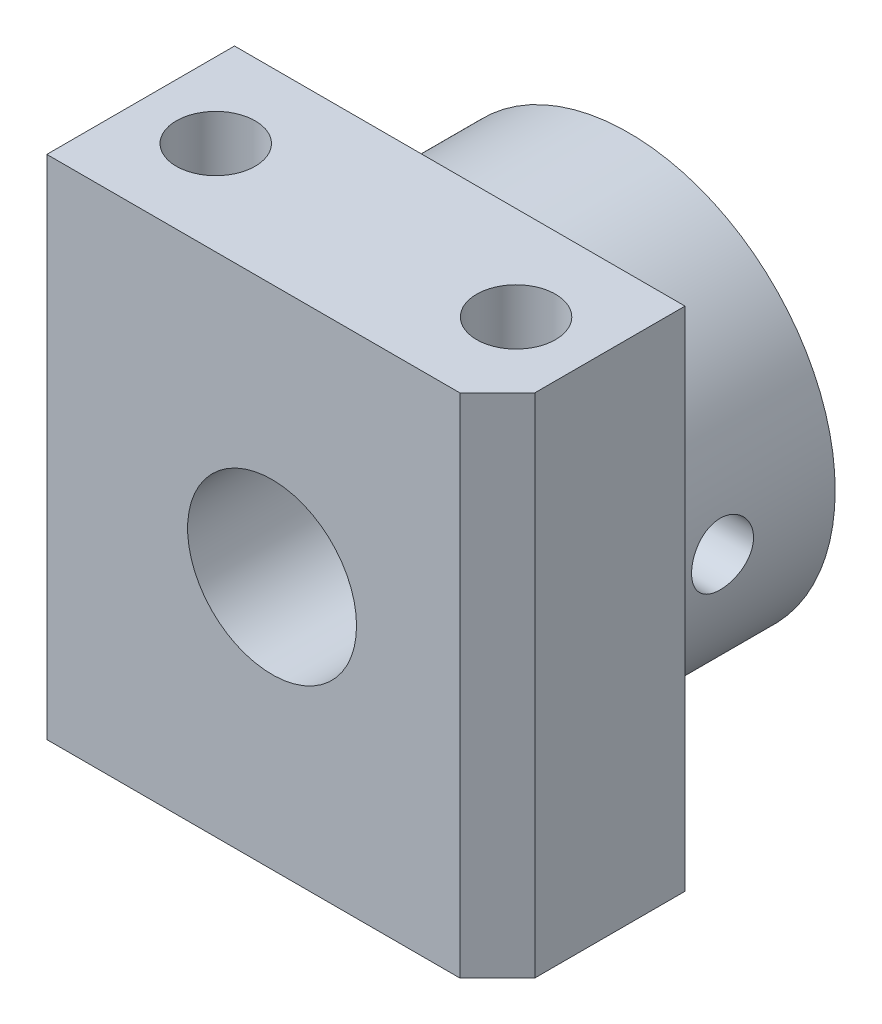
from build123d import *

# Parameters (mm, degrees)
SKETCH_1_W             = 24
SKETCH_1_H             = 27
EXTRUDE_1_DEPTH        = 10
SKETCH_2_R             = 11
SKETCH_2_R_2           = 4.5
EXTRUDE_2_DEPTH        = 9
CUT_EXTRUDE_START      = -41
SKETCH_3_R             = 4.5
CUT_EXTRUDE_1_DEPTH    = 41
SKETCH_4_R             = 2.1
CUT_EXTRUDE_2_DEPTH    = 37.013519789
CHAMFER_1_SIZE         = 2
HOLE_WIZARD_M4_1_D     = 3.3
HOLE_WIZARD_M4_1_DEPTH = 11.5
HOLE_WIZARD_M4_1_TIP   = 0.991420021


with BuildPart() as part:
    # 草图1 → 凸台-拉伸1 (new body)
    with BuildSketch(Plane.XY):
        Rectangle(SKETCH_1_W, SKETCH_1_H)
    extrude(amount=EXTRUDE_1_DEPTH)

    # 草图2 → 凸台-拉伸2 (add)
    with BuildSketch(Plane.XY):
        Circle(SKETCH_2_R)
        Circle(SKETCH_2_R_2, mode=Mode.SUBTRACT)
    extrude(amount=-EXTRUDE_2_DEPTH)

    # 草图3 → 切除-拉伸1 (cut)
    with BuildSketch(Plane(origin=(0, 0, 0), x_dir=(-1, 0, 0), z_dir=(0, 0, -1)).offset(CUT_EXTRUDE_START)):
        with Locations(Location((0, 0, 0), (0, 0, 180))):
            Circle(SKETCH_3_R)
    extrude(amount=CUT_EXTRUDE_1_DEPTH, mode=Mode.SUBTRACT)

    # 草图4 → 切除-拉伸2 (cut)
    with BuildSketch(Plane(origin=(0, 13.5, 0), x_dir=(1, 0, 0), z_dir=(0, 1, 0))):
        with Locations(Location((-8, -5, 0), (0, 0, 270))):
            Circle(SKETCH_4_R)
        with Locations(Location((8, -5, 0), (0, 0, 270))):
            Circle(SKETCH_4_R)
    extrude(amount=-CUT_EXTRUDE_2_DEPTH, mode=Mode.SUBTRACT)

    # 倒角1
    chamfer_1_edges = [part.edges().sort_by_distance(p)[0] for p in [
        (12, 0, 10),
    ]]
    chamfer(chamfer_1_edges, length=CHAMFER_1_SIZE)

    # M4 螺纹孔1
    with Locations(Plane(origin=(11, 0, 0), x_dir=(0, 0, -1), z_dir=(1, 0, 0))):
        with Locations((3, 0)):
            Hole(HOLE_WIZARD_M4_1_D / 2, depth=HOLE_WIZARD_M4_1_DEPTH)
            with Locations((0, 0, -(HOLE_WIZARD_M4_1_DEPTH + HOLE_WIZARD_M4_1_TIP / 2))):  # 118° drill point
                Cone(0, HOLE_WIZARD_M4_1_D / 2, HOLE_WIZARD_M4_1_TIP, mode=Mode.SUBTRACT)


solid = part.part
